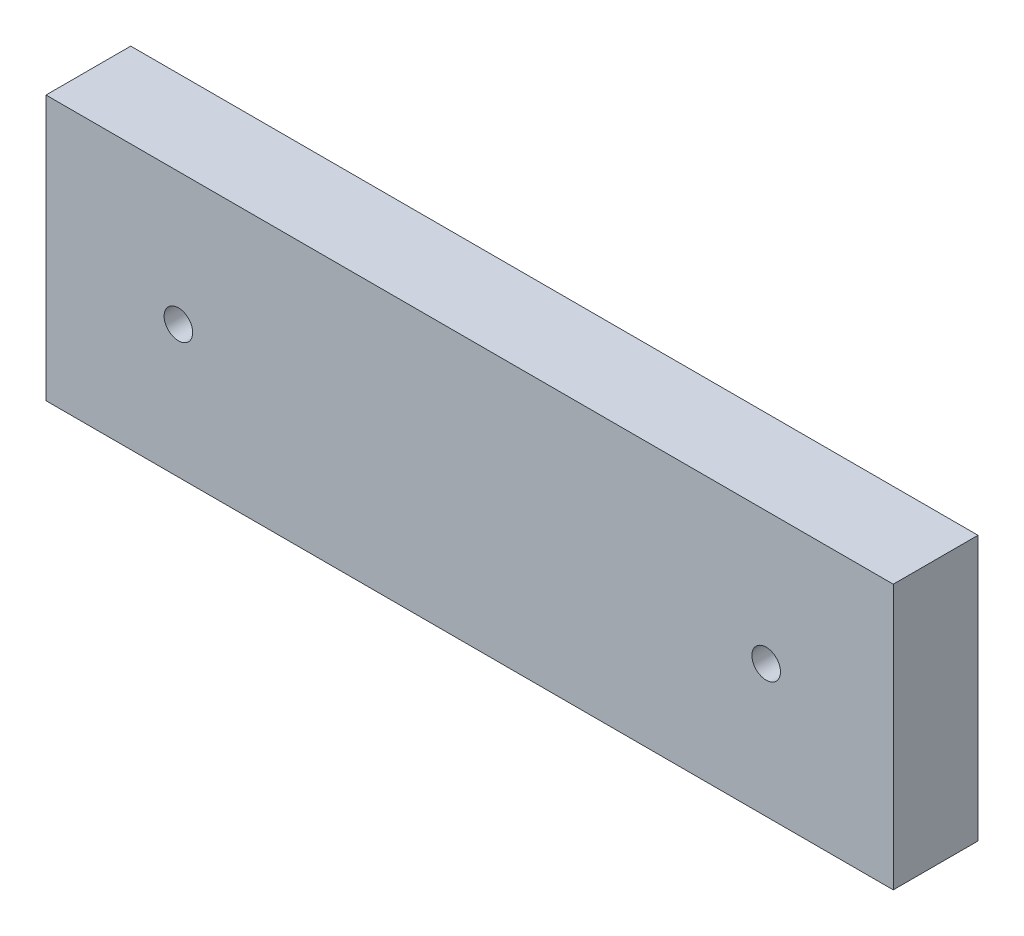
from build123d import *

# Parameters (mm, degrees)
SKETCH_1_W          = 80
SKETCH_1_H          = 25
EXTRUDE_1_DEPTH     = 8
EXTRUDE_2_DEPTH     = 1.7
SKETCH_5_W          = 2.2
SKETCH_5_H          = 1.7
CUT_EXTRUDE_1_DEPTH = 7
SKETCH_3_R          = 1.35
CUT_EXTRUDE_2_DEPTH = 85.374699999


with BuildPart() as part:
    # 草图1 → 凸台-拉伸1 (new body)
    with BuildSketch(Plane.XY):
        with Locations((40, -12.5)):
            Rectangle(SKETCH_1_W, SKETCH_1_H)
    extrude(amount=EXTRUDE_1_DEPTH)

    # 草图2 → 凸台-拉伸2 (add)
    with BuildSketch(Plane(origin=(0, 0, 0), x_dir=(-1, 0, 0), z_dir=(0, 0, -1))):
        with BuildLine():
            Line((-68, -10.85), (-12.5, -10.85))
            ThreePointArc((-12.5, -10.85), (-10.85, -12.5), (-12.5, -14.15))
            Line((-12.5, -14.15), (-68, -14.15))
            ThreePointArc((-68, -14.15), (-69.65, -12.5), (-68, -10.85))
        make_face()
    extrude(amount=EXTRUDE_2_DEPTH)

    # 草图5 → 切除-拉伸1 (cut)
    with BuildSketch(Plane.XZ.offset(14.15)):
        with Locations((40.2, -0.85)):
            Rectangle(SKETCH_5_W, SKETCH_5_H)
    extrude(amount=-CUT_EXTRUDE_1_DEPTH, mode=Mode.SUBTRACT)

    # 草图3 → 切除-拉伸2 (cut, through all)
    with BuildSketch(Plane(origin=(0, 0, -1.7), x_dir=(-1, 0, 0), z_dir=(0, 0, -1))):
        with Locations((-68, -12.5)):
            Circle(SKETCH_3_R)
        with Locations((-12.5, -12.5)):
            Circle(SKETCH_3_R)
    extrude(amount=-CUT_EXTRUDE_2_DEPTH, mode=Mode.SUBTRACT)


solid = part.part
